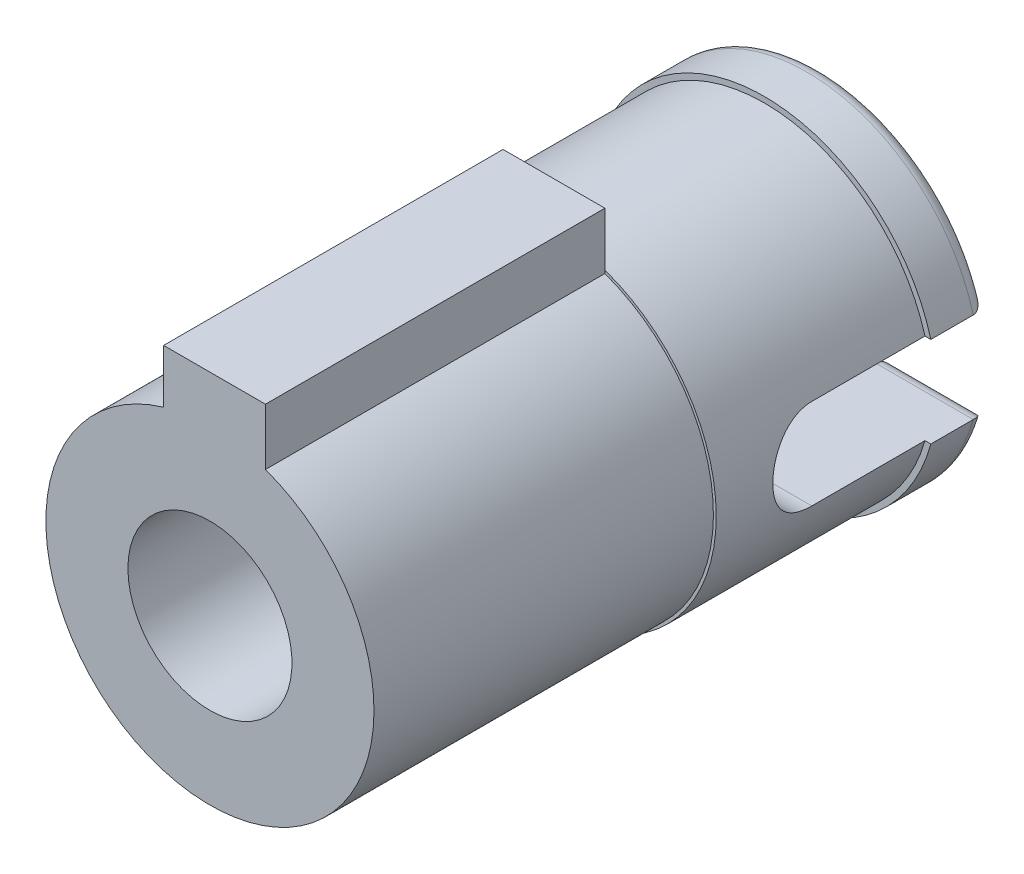
from build123d import *

# Parameters (mm, degrees)
SKETCH1_R               = 2.95
BOSS_EXTRUDE1_DEPTH     = 4.8
SKETCH10_R              = 3.05
BOSS_EXTRUDE2_DEPTH     = 1
CUT_EXTRUDE2_DEPTH      = 7.453293733
CUT_EXTRUDE2_DEPTH_BACK = 7.453293733
SKETCH1_4_R             = 1.45
CUT_EXTRUDE1_DEPTH      = 9
BOSS_EXTRUDE3_DEPTH     = 6
SKETCH12_R              = 1.45
CUT_EXTRUDE3_DEPTH      = 8.655520086
FILLET2_R               = 0.25


with BuildPart() as part:
    # Sketch1 → Boss-Extrude1 (new body)
    with BuildSketch(Plane(origin=(0, 0, 0), x_dir=(0, 1, 0), z_dir=(0, 0, 1))):
        with Locations(Location((0, 0, 0), (0, 0, 270))):
            Circle(SKETCH1_R)
    extrude(amount=BOSS_EXTRUDE1_DEPTH)

    # Sketch10 → Boss-Extrude2 (add)
    with BuildSketch(Plane(origin=(0, 0, 0), x_dir=(0, 1, 0), z_dir=(0, 0, 1))):
        with Locations(Location((0, 0, 0), (0, 0, 270))):
            Circle(SKETCH10_R)
    extrude(amount=BOSS_EXTRUDE2_DEPTH)

    # Sketch3 → Cut-Extrude2 (cut, two sides: drawn at the far end of the back side and taken through both)
    with BuildSketch(Plane.YZ.offset(-CUT_EXTRUDE2_DEPTH_BACK)):
        with BuildLine():
            Line((-0.8, -0.344662329), (-0.8, 3))
            ThreePointArc((-0.8, 3), (0, 3.8), (0.8, 3))
            Line((0.8, 3), (0.8, -0.344662329))
            ThreePointArc((0.8, -0.344662329), (0, -1.144662329), (-0.8, -0.344662329))
        make_face()
    extrude(amount=CUT_EXTRUDE2_DEPTH + CUT_EXTRUDE2_DEPTH_BACK, mode=Mode.SUBTRACT)

    # Sketch1<4> → Cut-Extrude1 (cut)
    with BuildSketch(Plane(origin=(0, 0, 0), x_dir=(0, 1, 0), z_dir=(0, 0, 1))):
        with Locations(Location((0, 0, 0), (0, 0, 56.514623377))):
            Circle(SKETCH1_4_R)
    extrude(amount=CUT_EXTRUDE1_DEPTH, mode=Mode.SUBTRACT)

    # Sketch11 → Boss-Extrude3 (add)
    with BuildSketch(Plane.XY.offset(4.8)):
        with BuildLine():
            Line((-0.818543418, 3.728872107), (0.981456582, 3.728872107))
            Line((0.981456582, 3.728872107), (0.981456582, 2.728872107))
            ThreePointArc((0.981456582, 2.728872107), (-0.085691473, -2.898733684), (-0.818543418, 2.782083153))
            Line((-0.818543418, 2.782083153), (-0.818543418, 3.728872107))
        make_face()
    extrude(amount=BOSS_EXTRUDE3_DEPTH)

    # Sketch12 → Cut-Extrude3 (cut, through all)
    with BuildSketch(Plane(origin=(0, 0, 4.8), x_dir=(1, 0, 0), z_dir=(0, 0, -1))):
        with Locations(Location((0, 0, 0), (0, 0, 180))):
            Circle(SKETCH12_R)
    extrude(amount=-CUT_EXTRUDE3_DEPTH, mode=Mode.SUBTRACT)

    # Fillet2
    fillet2_edges = [part.edges().sort_by_distance(p)[0] for p in [
        (0, 3.05, 0),
        (0, -3.05, 0),
        (2.076275596, 0.8, 0),
        (-2.076275596, -0.8, 0),
        (-2.076275596, 0.8, 0),
        (2.076275596, -0.8, 0),
        (0, 1.45, 0),
        (0, -1.45, 0),
    ]]
    fillet(fillet2_edges, radius=FILLET2_R)


solid = part.part
